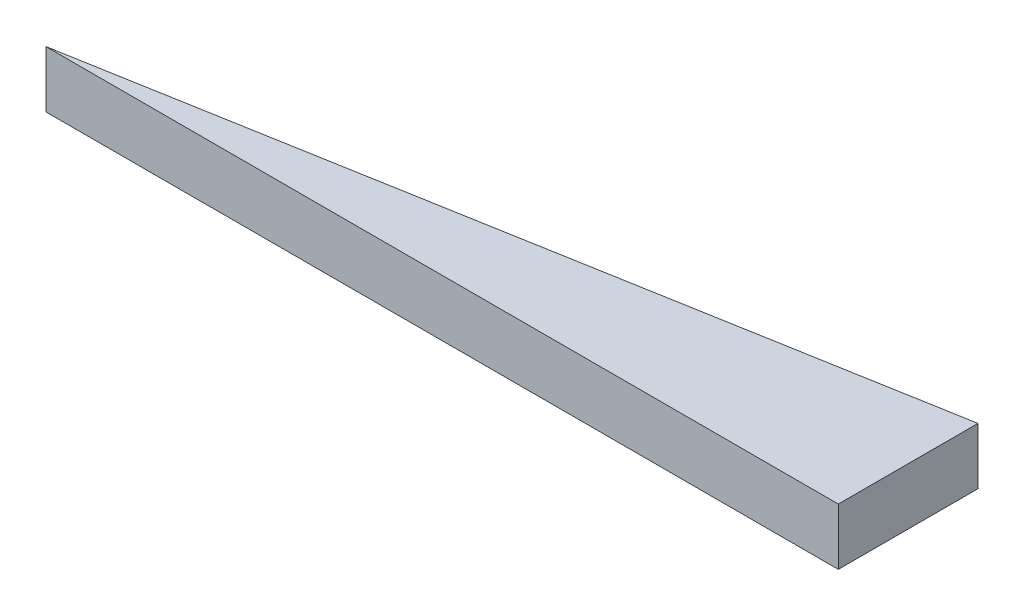
from build123d import *

# Parameters (mm, degrees)
BOSS_EXTRUDE1_DEPTH = 12.7


with BuildPart() as part:
    # Sketch1 → Boss-Extrude1 (new body)
    with BuildSketch(Plane(origin=(0, 0, 0), x_dir=(1, 0, 0), z_dir=(0, 1, 0))):
        Polygon((0, 0), (177.8, 0), (177.8, 31.35093717), align=None)
    extrude(amount=BOSS_EXTRUDE1_DEPTH)


solid = part.part
